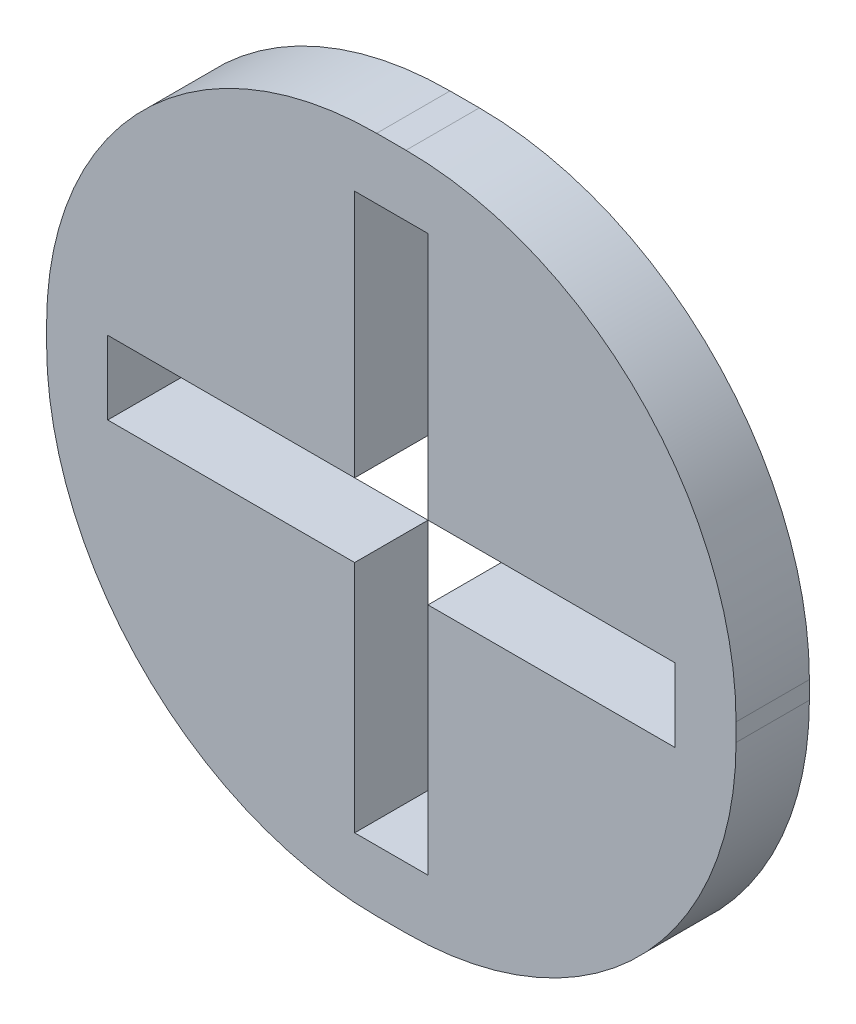
from build123d import *

# Parameters (mm, degrees)
SALIENTE_EXTRUIR1_DEPTH = 3


with BuildPart() as part:
    # Croquis1 → Saliente-Extruir1 (new body)
    with BuildSketch(Plane.XY):
        with BuildLine():
            Line((-0.6, -13.865), (0.6, -13.865))
            ThreePointArc((0.6, -13.865), (10.145941546, -9.910941546), (14.1, -0.365))
            Line((14.1, -0.365), (14.1, 0.365))
            ThreePointArc((14.1, 0.365), (10.145941546, 9.910941546), (0.6, 13.865))
            Line((0.6, 13.865), (-0.6, 13.865))
            ThreePointArc((-0.6, 13.865), (-10.145941546, 9.910941546), (-14.1, 0.365))
            Line((-14.1, 0.365), (-14.1, -0.365))
            ThreePointArc((-14.1, -0.365), (-10.145941546, -9.910941546), (-0.6, -13.865))
        make_face()
        Polygon((-11.6, -1.79), (-11.6, 1.21), (-1.5, 1.21), (-1.5, 11.365), (1.5, 11.365), (1.5, 1.21), (11.6, 1.21), (11.6, -1.79), (1.5, -1.79), (1.5, -11.365), (-1.5, -11.365), (-1.5, -1.79), align=None, mode=Mode.SUBTRACT)
    extrude(amount=SALIENTE_EXTRUIR1_DEPTH)


solid = part.part
